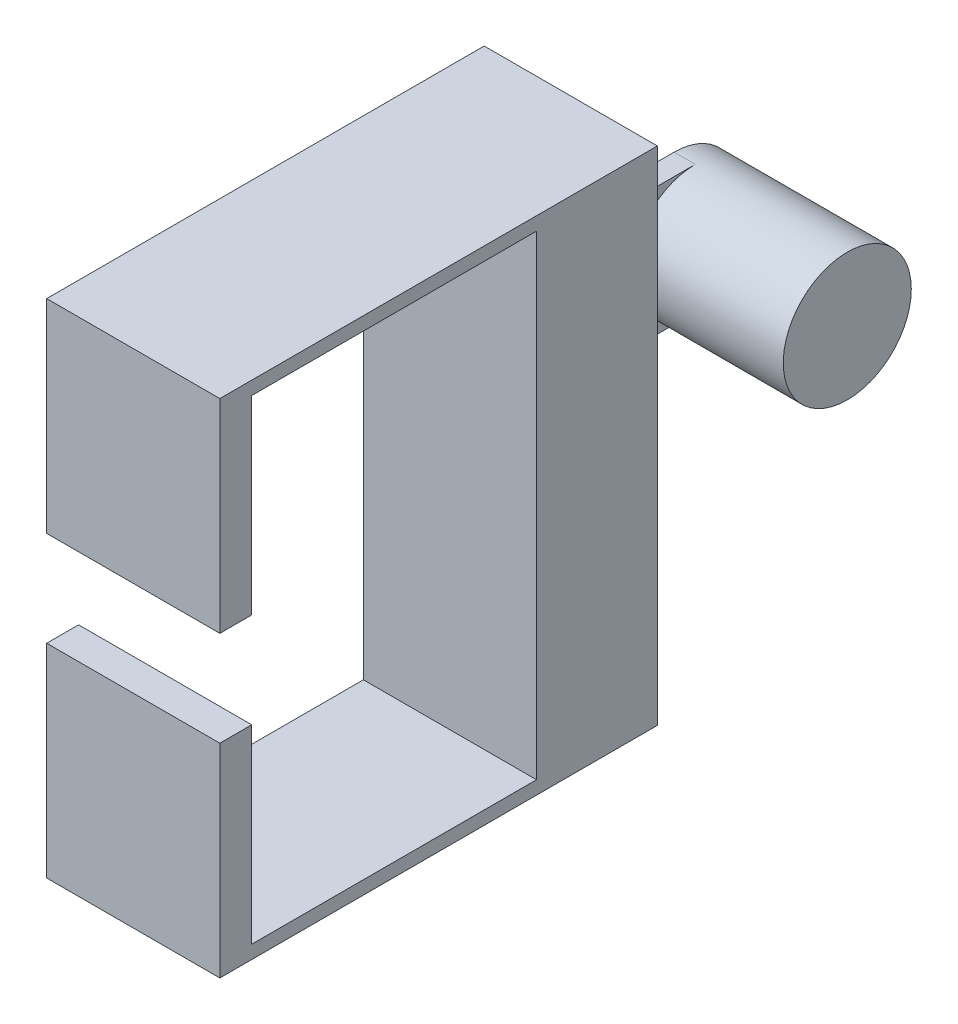
from build123d import *

# Parameters (mm, degrees)
SKETCH1_R                = 8.562349171
BOSS_EXTRUDE1_DEPTH      = 20.32
BOSS_EXTRUDE2_START      = -2.833688097
SKETCH1_5_R              = 8.562349171
BOSS_EXTRUDE2_DEPTH      = 2.833688097
BOSS_EXTRUDE3_DEPTH      = 20.32
BOSS_EXTRUDE3_DEPTH_BACK = 2.833688097


with BuildPart() as part:
    # Sketch1 → Boss-Extrude1 (new body)
    with BuildSketch(Plane.YZ):
        with Locations(Location((0, 0, 0), (0, 0, 270))):
            Circle(SKETCH1_R)
    extrude(amount=BOSS_EXTRUDE1_DEPTH)

    # Sketch1<5> → Boss-Extrude2 (add)
    with BuildSketch(Plane.YZ.offset(BOSS_EXTRUDE2_START)):
        with Locations(Location((0, 0, 0), (0, 0, 180))):
            Circle(SKETCH1_5_R)
        with BuildLine():
            Line((8.562349171, 25.4), (-8.562349171, 25.4))
            Line((-8.562349171, 25.4), (-8.562349171, 0))
            ThreePointArc((-8.562349171, 0), (0, 8.562349171), (8.562349171, 0))
            Line((8.562349171, 0), (8.562349171, 25.4))
        make_face()
    extrude(amount=BOSS_EXTRUDE2_DEPTH)

    # Sketch1<6> → Boss-Extrude3 (add, two sides: drawn at the far end of the back side and taken through both)
    with BuildSketch(Plane.YZ.offset(-BOSS_EXTRUDE3_DEPTH_BACK)):
        Polygon((-33.554191153, 25.4), (-8.562349171, 25.4), (8.562349171, 25.4), (33.554191153, 25.4), (33.554191153, 83.9097483), (6.36016, 83.9097483), (6.36016, 79.644886138), (31.77032, 79.644886138), (31.77032, 41.557586138), (-31.77032, 41.557586138), (-31.77032, 79.644886138), (-6.36016, 79.644886138), (-6.36016, 83.9097483), (-33.554191153, 83.9097483), align=None)
    extrude(amount=BOSS_EXTRUDE3_DEPTH + BOSS_EXTRUDE3_DEPTH_BACK)


solid = part.part
